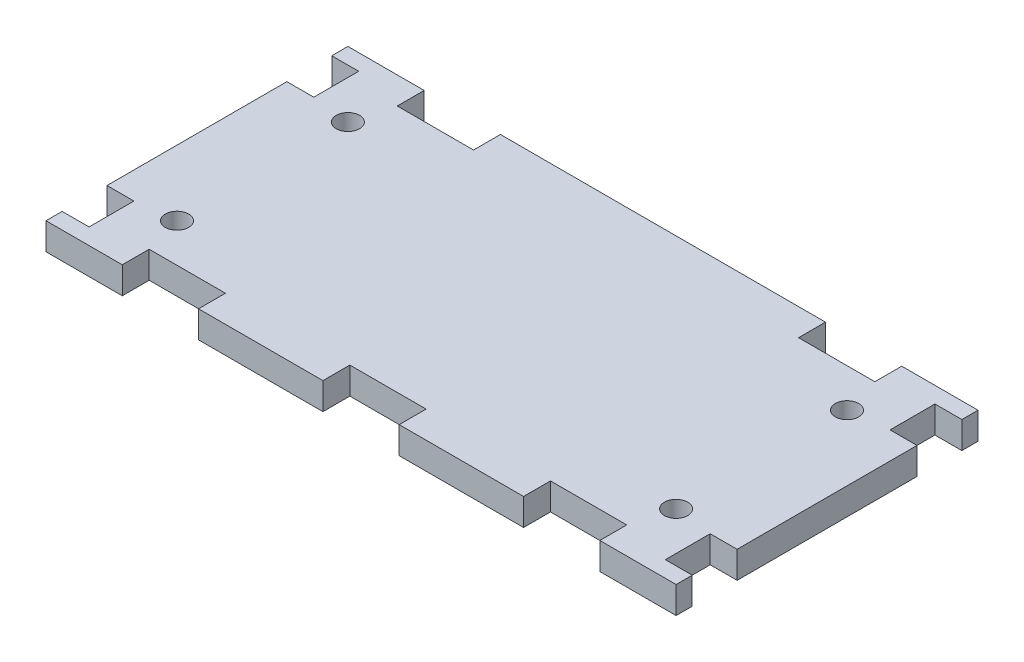
from build123d import *

# Parameters (mm, degrees)
CROQUIS1_R              = 1.3
SALIENTE_EXTRUIR1_DEPTH = 3


with BuildPart() as part:
    # Croquis1 → Saliente-Extruir1 (new body)
    with BuildSketch(Plane(origin=(0, 0, 0), x_dir=(1, 0, 0), z_dir=(0, 1, 0))):
        Polygon((17, 33.65), (30.865, 33.65), (39.365, 33.65), (53.23, 33.65), (53.23, 30.65), (61.73, 30.65), (61.73, 33.65), (70.23, 33.65), (70.23, 31.85), (67.23, 31.85), (67.23, 26.85), (70.23, 26.85), (70.23, 6.8), (67.23, 6.8), (67.23, 1.8), (70.23, 1.8), (70.23, 0), (61.73, 0), (61.73, 3), (53.23, 3), (53.23, 0), (39.365, 0), (39.365, 3), (30.865, 3), (30.865, 0), (17, 0), (17, 3), (8.5, 3), (8.5, 0), (0, 0), (0, 1.8), (3, 1.8), (3, 6.8), (0, 6.8), (0, 26.85), (3, 26.85), (3, 31.85), (0, 31.85), (0, 33.65), (8.5, 33.65), (8.5, 30.65), (17, 30.65), align=None)
        with Locations(Location((7.3, 26.35, 0), (0, 0, 270))):
            Circle(CROQUIS1_R, mode=Mode.SUBTRACT)
        with Locations(Location((7.3, 7.3, 0), (0, 0, 270))):
            Circle(CROQUIS1_R, mode=Mode.SUBTRACT)
        with Locations(Location((62.93, 26.35, 0), (0, 0, 270))):
            Circle(CROQUIS1_R, mode=Mode.SUBTRACT)
        with Locations(Location((62.93, 7.3, 0), (0, 0, 270))):
            Circle(CROQUIS1_R, mode=Mode.SUBTRACT)
    extrude(amount=SALIENTE_EXTRUIR1_DEPTH)


solid = part.part
